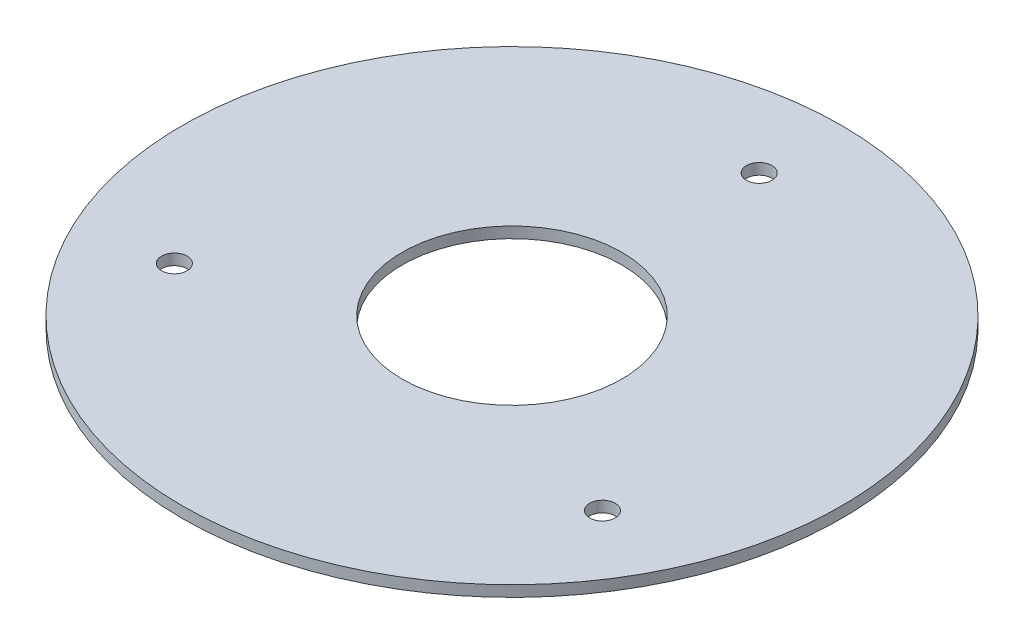
from build123d import *

# Parameters (mm, degrees)
SKETCH1_R           = 60
SKETCH1_R_2         = 20
SKETCH1_R_3         = 2.32306613
BOSS_EXTRUDE1_DEPTH = 2


with BuildPart() as part:
    # Sketch1 → Boss-Extrude1 (new body)
    with BuildSketch(Plane(origin=(0, 0, 0), x_dir=(1, 0, 0), z_dir=(0, 1, 0))):
        with Locations(Location((0, 0, 0), (0, 0, 270))):
            Circle(SKETCH1_R)
        with Locations(Location((0, 0, 0), (0, 0, 270))):
            Circle(SKETCH1_R_2, mode=Mode.SUBTRACT)
        with Locations(Location((0, 45.00344982, 0), (0, 0, 270))):
            Circle(SKETCH1_R_3, mode=Mode.SUBTRACT)
        with Locations(Location((38.974130802, -22.50172491, 0), (0, 0, 270))):
            Circle(SKETCH1_R_3, mode=Mode.SUBTRACT)
        with Locations(Location((-38.974130802, -22.50172491, 0), (0, 0, 270))):
            Circle(SKETCH1_R_3, mode=Mode.SUBTRACT)
    extrude(amount=BOSS_EXTRUDE1_DEPTH)


solid = part.part
